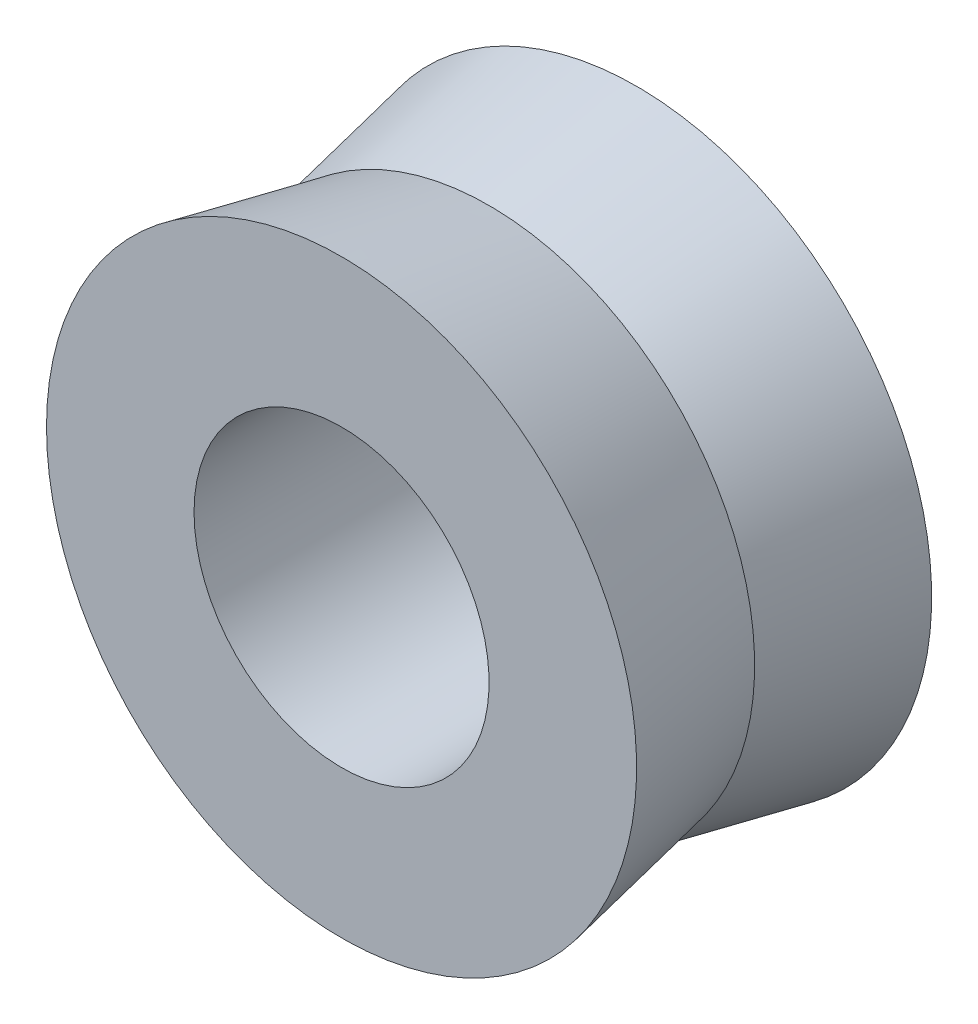
from build123d import *


with BuildPart() as part:
    # Sketch1 → Revolve1 (revolve)
    with BuildSketch(Plane(origin=(0, 0, 0), x_dir=(1, 0, 0), z_dir=(0, 1, 0))):
        Polygon((-12.7, 0), (-6.35, 0), (-6.35, 6.35), (-11.43, 6.35), align=None)
        Polygon((-11.43, 6.35), (-6.35, 6.35), (-6.35, 12.7), (-12.7, 12.7), align=None)
    revolve(axis=Axis((0, 0, -12.7), (0, 0, 1)))


solid = part.part
